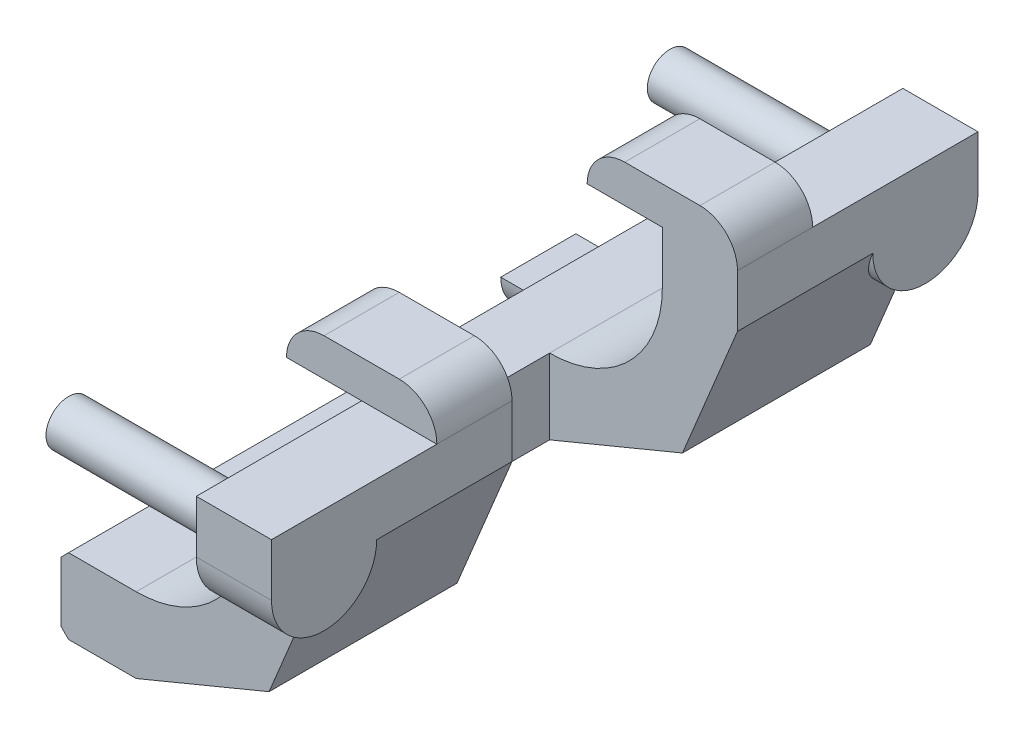
from build123d import *

# Parameters (mm, degrees)
BOSS_EXTRUDE1_DEPTH   = 10
BOSS_EXTRUDE1_2_DEPTH = 10
BOSS_EXTRUDE2_START   = -7
BOSS_EXTRUDE2_DEPTH   = 80
CUT_EXTRUDE1_START    = 2
CUT_EXTRUDE1_DEPTH    = 2
SKETCH9_W             = 80
SKETCH9_H             = 10
BOSS_EXTRUDE4_DEPTH   = 10
CUT_EXTRUDE3_DEPTH    = 80
CUT_EXTRUDE4_START    = -32
CUT_EXTRUDE4_DEPTH    = 30
SKETCH7_R             = 3
BOSS_EXTRUDE5_DEPTH   = 24
BOSS_EXTRUDE6_DEPTH   = 10
BOSS_EXTRUDE8_START   = 10
BOSS_EXTRUDE8_DEPTH   = 10
BOSS_EXTRUDE3_DEPTH   = 4
CUT_EXTRUDE5_DEPTH    = 4


with BuildPart() as part:
    # Sketch3 → Boss-Extrude1 (new body)
    with BuildSketch(Plane(origin=(0, 0, 0), x_dir=(0, 0, -1), z_dir=(1, 0, 0))):
        with BuildLine():
            Line((-47, 7), (-47, 0))
            ThreePointArc((-47, 0), (-40, -7), (-33, 0))
            Line((-33, 0), (-15, 0))
            Line((-15, 0), (-15, 7))
            Line((-15, 7), (-47, 7))
        make_face()
    extrude(amount=BOSS_EXTRUDE1_DEPTH)

    # Sketch5 → Boss-Extrude2 (add)
    with BuildSketch(Plane(origin=(0, 0, -47), x_dir=(-1, 0, 0), z_dir=(0, 0, -1)).offset(BOSS_EXTRUDE2_START)):
        with BuildLine():
            Line((-10, 0), (0, 0))
            ThreePointArc((0, 0), (4.393398282, -10.606601718), (15, -15))
            Line((15, -15), (15, -25))
            Line((15, -25), (-2.67766953, -17.67766953))
            Line((-2.67766953, -17.67766953), (-10, 0))
        make_face()
    extrude(amount=-BOSS_EXTRUDE2_DEPTH)

    # Sketch6 → Cut-Extrude1 (cut)
    with BuildSketch(Plane.ZY.offset(CUT_EXTRUDE1_START)):
        with BuildLine():
            Line((-33, 0), (-40, 0))
            Line((-40, 0), (-40, -7))
            ThreePointArc((-40, -7), (-35.050252532, -4.949747468), (-33, 0))
        make_face()
        with BuildLine():
            Line((40, 0), (33, 0))
            ThreePointArc((33, 0), (35.050252532, -4.949747468), (40, -7))
            Line((40, -7), (40, 0))
        make_face()
    extrude(amount=-CUT_EXTRUDE1_DEPTH, mode=Mode.SUBTRACT)

    # Sketch9 → Boss-Extrude4 (add)
    with BuildSketch(Plane.ZY.offset(15)):
        with Locations((0, -20)):
            Rectangle(SKETCH9_W, SKETCH9_H)
    extrude(amount=BOSS_EXTRUDE4_DEPTH)

    # Sketch10 → Cut-Extrude3 (cut)
    with BuildSketch(Plane(origin=(0, 0, -40), x_dir=(-1, 0, 0), z_dir=(0, 0, -1))):
        Polygon((25, -15), (24, -15), (25, -16), align=None)
        Polygon((25, -25), (24, -25), (25, -24), align=None)
    extrude(amount=-CUT_EXTRUDE3_DEPTH, mode=Mode.SUBTRACT)

    # Sketch5<3> → Cut-Extrude4 (cut)
    with BuildSketch(Plane(origin=(0, 0, -47), x_dir=(-1, 0, 0), z_dir=(0, 0, -1)).offset(CUT_EXTRUDE4_START)):
        with BuildLine():
            Line((0, 0), (-10, 0))
            Line((-10, 0), (-2.67766953, -17.67766953))
            Line((-2.67766953, -17.67766953), (15, -25))
            Line((15, -25), (15, -15))
            ThreePointArc((15, -15), (4.393398282, -10.606601718), (0, 0))
        make_face()
    extrude(amount=-CUT_EXTRUDE4_DEPTH, mode=Mode.SUBTRACT)



with BuildPart() as body_2:
    # Sketch3 → Boss-Extrude1 2 (new body)
    with BuildSketch(Plane(origin=(0, 0, 0), x_dir=(0, 0, -1), z_dir=(1, 0, 0))):
        with BuildLine():
            Line((15, 7), (15, 0))
            Line((15, 0), (33, 0))
            ThreePointArc((33, 0), (40, -7), (47, 0))
            Line((47, 0), (47, 7))
            Line((47, 7), (15, 7))
        make_face()
    extrude(amount=BOSS_EXTRUDE1_2_DEPTH)


with BuildPart() as part_1:
    add(part.part)

    add(body_2.part)  # Boss-Extrude5 merges body 2
    # Sketch7 → Boss-Extrude5 (add)
    with BuildSketch(Plane.ZY):
        with Locations((-40, 0)):
            Circle(SKETCH7_R)
        with Locations(Location((40, 0, 0), (0, 0, 180))):
            Circle(SKETCH7_R)
    extrude(amount=BOSS_EXTRUDE5_DEPTH)

    # Sketch11 → Boss-Extrude6 (add)
    with BuildSketch(Plane.XY.offset(-15)):
        with BuildLine():
            Line((-10, 7), (0, 7))
            Line((0, 7), (10, 7))
            ThreePointArc((10, 7), (8.535533906, 10.535533906), (5, 12))
            Line((5, 12), (-5, 12))
            ThreePointArc((-5, 12), (-8.535533906, 10.535533906), (-10, 7))
        make_face()
    extrude(amount=-BOSS_EXTRUDE6_DEPTH)

    # Sketch13 → Boss-Extrude8 (add)
    with BuildSketch(Plane.XY.offset(15).offset(BOSS_EXTRUDE8_START)):
        with BuildLine():
            Line((-10, 7), (0, 7))
            Line((0, 7), (10, 7))
            ThreePointArc((10, 7), (8.535533906, 10.535533906), (5, 12))
            Line((5, 12), (-5, 12))
            ThreePointArc((-5, 12), (-8.535533906, 10.535533906), (-10, 7))
        make_face()
    extrude(amount=-BOSS_EXTRUDE8_DEPTH)

    # Sketch8 → Boss-Extrude3 (add)
    with BuildSketch(Plane.ZY.offset(25)):
        with BuildLine():
            Line((-32.5, -17), (-22.5, -17))
            ThreePointArc((-22.5, -17), (-27.5, -22), (-32.5, -17))
        make_face()
    extrude(amount=BOSS_EXTRUDE3_DEPTH)

    # Sketch8<4> → Cut-Extrude5 (cut)
    with BuildSketch(Plane.ZY.offset(25)):
        with BuildLine():
            Line((32.5, -17), (22.5, -17))
            ThreePointArc((22.5, -17), (27.5, -22), (32.5, -17))
        make_face()
    extrude(amount=-CUT_EXTRUDE5_DEPTH, mode=Mode.SUBTRACT)


solid = part_1.part
